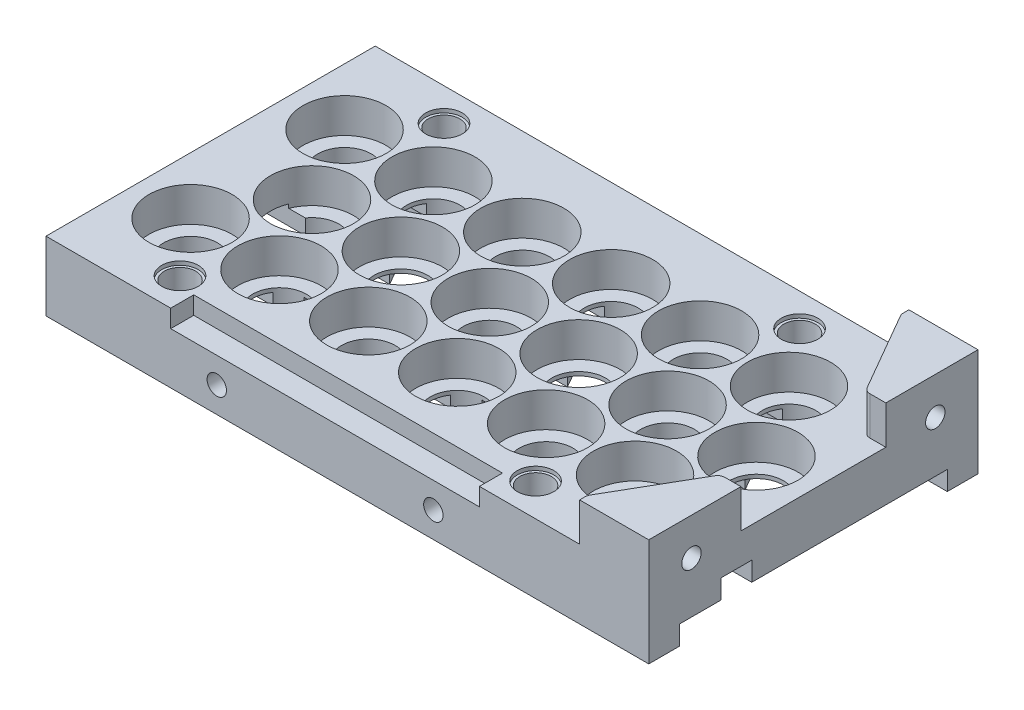
from build123d import *

# Parameters (mm, degrees)
BOSS_EXTRUDE2_DEPTH      = 11
BOSS_EXTRUDE2_DEPTH_BACK = 2
SKETCH1_W                = 156.975
SKETCH1_H                = 85.746976195
SKETCH1_R                = 10.825
BOSS_EXTRUDE3_DEPTH      = 2
BOSS_EXTRUDE3_DEPTH_BACK = 2
SKETCH1_3_R              = 10.825
SKETCH1_3_R_2            = 7
CUT_EXTRUDE3_REACH       = 157.996
SKETCH9_R                = 4.1
SKETCH10_R               = 4.7625
CUT_EXTRUDE4_DEPTH       = 1
SKETCH13_W               = 17.3
SKETCH13_H               = 8
SKETCH13_W_2             = 74.4
SKETCH13_W_3             = 28.875
BOSS_EXTRUDE7_DEPTH      = 5
CUT_EXTRUDE1_DEPTH       = 3
SKETCH19_W               = 80.4
SKETCH19_H               = 4.625
CUT_EXTRUDE6_DEPTH       = 6
SKETCH20_R               = 2.525
CUT_EXTRUDE7_DEPTH       = 3.8862
BOSS_EXTRUDE8_DEPTH      = 10
SKETCH22_R               = 2.525
CUT_EXTRUDE8_DEPTH       = 3.81
SKETCH26_R               = 1.9431
CUT_EXTRUDE9_DEPTH       = 5
CUT_EXTRUDE10_DEPTH      = 5
SKETCH28_R               = 1.9431
CUT_EXTRUDE11_DEPTH      = 5
FILLET4_R                = 2


with BuildPart() as part:
    # Sketch1 → Boss-Extrude2 (new, two sides: drawn at the far end of the back side and taken through both)
    with BuildSketch(Plane(origin=(0, 0, 0), x_dir=(1, 0, 0), z_dir=(0, 1, 0)).offset(-BOSS_EXTRUDE2_DEPTH_BACK)):
        with Locations((63.6625, -20.048488098)):
            Rectangle(SKETCH1_W, SKETCH1_H)
        with Locations(Location((115.75, -40.096976195, 0), (0, 0, 270))):
            Circle(SKETCH1_R, mode=Mode.SUBTRACT)
        with Locations(Location((127.325, -20.048488098, 0), (0, 0, 270))):
            Circle(SKETCH1_R, mode=Mode.SUBTRACT)
        with Locations(Location((115.75, 0, 0), (0, 0, 270))):
            Circle(SKETCH1_R, mode=Mode.SUBTRACT)
        with Locations(Location((92.6, -40.096976195, 0), (0, 0, 270))):
            Circle(SKETCH1_R, mode=Mode.SUBTRACT)
        with Locations(Location((104.175, -20.048488098, 0), (0, 0, 270))):
            Circle(SKETCH1_R, mode=Mode.SUBTRACT)
        with Locations(Location((92.6, 0, 0), (0, 0, 270))):
            Circle(SKETCH1_R, mode=Mode.SUBTRACT)
        with Locations(Location((69.45, -40.096976195, 0), (0, 0, 270))):
            Circle(SKETCH1_R, mode=Mode.SUBTRACT)
        with Locations(Location((81.025, -20.048488098, 0), (0, 0, 270))):
            Circle(SKETCH1_R, mode=Mode.SUBTRACT)
        with Locations(Location((69.45, 0, 0), (0, 0, 270))):
            Circle(SKETCH1_R, mode=Mode.SUBTRACT)
        with Locations(Location((46.3, -40.096976195, 0), (0, 0, 270))):
            Circle(SKETCH1_R, mode=Mode.SUBTRACT)
        with Locations(Location((57.875, -20.048488098, 0), (0, 0, 270))):
            Circle(SKETCH1_R, mode=Mode.SUBTRACT)
        with Locations(Location((46.3, 0, 0), (0, 0, 270))):
            Circle(SKETCH1_R, mode=Mode.SUBTRACT)
        with Locations(Location((23.15, -40.096976195, 0), (0, 0, 270))):
            Circle(SKETCH1_R, mode=Mode.SUBTRACT)
        with Locations(Location((34.725, -20.048488098, 0), (0, 0, 270))):
            Circle(SKETCH1_R, mode=Mode.SUBTRACT)
        with Locations(Location((23.15, 0, 0), (0, 0, 270))):
            Circle(SKETCH1_R, mode=Mode.SUBTRACT)
        with Locations(Location((0, -40.096976195, 0), (0, 0, 270))):
            Circle(SKETCH1_R, mode=Mode.SUBTRACT)
        with Locations(Location((11.575, -20.048488098, 0), (0, 0, 270))):
            Circle(SKETCH1_R, mode=Mode.SUBTRACT)
        with Locations(Location((0, 0, 0), (0, 0, 270))):
            Circle(SKETCH1_R, mode=Mode.SUBTRACT)
    extrude(amount=BOSS_EXTRUDE2_DEPTH + BOSS_EXTRUDE2_DEPTH_BACK)

    # Sketch1<3> → Boss-Extrude3 (add, two sides: drawn at the far end of the back side and taken through both)
    # profile 1 of 18: a face of its own
    with BuildSketch(Plane(origin=(0, 0, 0), x_dir=(1, 0, 0), z_dir=(0, 1, 0)).offset(-BOSS_EXTRUDE3_DEPTH_BACK)):
        with Locations(Location((0, 0, 0), (0, 0, 270))):
            Circle(SKETCH1_3_R)
        with Locations(Location((0, 0, 0), (0, 0, 270))):
            Circle(SKETCH1_3_R_2, mode=Mode.SUBTRACT)
    # profile 2 of 18: a face of its own
    with BuildSketch(Plane(origin=(0, 0, 0), x_dir=(1, 0, 0), z_dir=(0, 1, 0)).offset(-BOSS_EXTRUDE3_DEPTH_BACK)):
        with Locations(Location((23.15, 0, 0), (0, 0, 270))):
            Circle(SKETCH1_3_R)
        with Locations(Location((23.15, 0, 0), (0, 0, 270))):
            Circle(SKETCH1_3_R_2, mode=Mode.SUBTRACT)
    # profile 3 of 18: a face of its own
    with BuildSketch(Plane(origin=(0, 0, 0), x_dir=(1, 0, 0), z_dir=(0, 1, 0)).offset(-BOSS_EXTRUDE3_DEPTH_BACK)):
        with Locations(Location((46.3, 0, 0), (0, 0, 270))):
            Circle(SKETCH1_3_R)
        with Locations(Location((46.3, 0, 0), (0, 0, 270))):
            Circle(SKETCH1_3_R_2, mode=Mode.SUBTRACT)
    # profile 4 of 18: a face of its own
    with BuildSketch(Plane(origin=(0, 0, 0), x_dir=(1, 0, 0), z_dir=(0, 1, 0)).offset(-BOSS_EXTRUDE3_DEPTH_BACK)):
        with Locations(Location((69.45, 0, 0), (0, 0, 270))):
            Circle(SKETCH1_3_R)
        with Locations(Location((69.45, 0, 0), (0, 0, 270))):
            Circle(SKETCH1_3_R_2, mode=Mode.SUBTRACT)
    # profile 5 of 18: a face of its own
    with BuildSketch(Plane(origin=(0, 0, 0), x_dir=(1, 0, 0), z_dir=(0, 1, 0)).offset(-BOSS_EXTRUDE3_DEPTH_BACK)):
        with Locations(Location((92.6, 0, 0), (0, 0, 270))):
            Circle(SKETCH1_3_R)
        with Locations(Location((92.6, 0, 0), (0, 0, 270))):
            Circle(SKETCH1_3_R_2, mode=Mode.SUBTRACT)
    # profile 6 of 18: a face of its own
    with BuildSketch(Plane(origin=(0, 0, 0), x_dir=(1, 0, 0), z_dir=(0, 1, 0)).offset(-BOSS_EXTRUDE3_DEPTH_BACK)):
        with Locations(Location((115.75, 0, 0), (0, 0, 270))):
            Circle(SKETCH1_3_R)
        with Locations(Location((115.75, 0, 0), (0, 0, 270))):
            Circle(SKETCH1_3_R_2, mode=Mode.SUBTRACT)
    # profile 7 of 18: a face of its own
    with BuildSketch(Plane(origin=(0, 0, 0), x_dir=(1, 0, 0), z_dir=(0, 1, 0)).offset(-BOSS_EXTRUDE3_DEPTH_BACK)):
        with Locations(Location((11.575, -20.048488098, 0), (0, 0, 270))):
            Circle(SKETCH1_3_R)
        with Locations(Location((11.575, -20.048488098, 0), (0, 0, 270))):
            Circle(SKETCH1_3_R_2, mode=Mode.SUBTRACT)
    # profile 8 of 18: a face of its own
    with BuildSketch(Plane(origin=(0, 0, 0), x_dir=(1, 0, 0), z_dir=(0, 1, 0)).offset(-BOSS_EXTRUDE3_DEPTH_BACK)):
        with Locations(Location((34.725, -20.048488098, 0), (0, 0, 270))):
            Circle(SKETCH1_3_R)
        with Locations(Location((34.725, -20.048488098, 0), (0, 0, 270))):
            Circle(SKETCH1_3_R_2, mode=Mode.SUBTRACT)
    # profile 9 of 18: a face of its own
    with BuildSketch(Plane(origin=(0, 0, 0), x_dir=(1, 0, 0), z_dir=(0, 1, 0)).offset(-BOSS_EXTRUDE3_DEPTH_BACK)):
        with Locations(Location((57.875, -20.048488098, 0), (0, 0, 270))):
            Circle(SKETCH1_3_R)
        with Locations(Location((57.875, -20.048488098, 0), (0, 0, 270))):
            Circle(SKETCH1_3_R_2, mode=Mode.SUBTRACT)
    # profile 10 of 18: a face of its own
    with BuildSketch(Plane(origin=(0, 0, 0), x_dir=(1, 0, 0), z_dir=(0, 1, 0)).offset(-BOSS_EXTRUDE3_DEPTH_BACK)):
        with Locations(Location((81.025, -20.048488098, 0), (0, 0, 270))):
            Circle(SKETCH1_3_R)
        with Locations(Location((81.025, -20.048488098, 0), (0, 0, 270))):
            Circle(SKETCH1_3_R_2, mode=Mode.SUBTRACT)
    # profile 11 of 18: a face of its own
    with BuildSketch(Plane(origin=(0, 0, 0), x_dir=(1, 0, 0), z_dir=(0, 1, 0)).offset(-BOSS_EXTRUDE3_DEPTH_BACK)):
        with Locations(Location((104.175, -20.048488098, 0), (0, 0, 270))):
            Circle(SKETCH1_3_R)
        with Locations(Location((104.175, -20.048488098, 0), (0, 0, 270))):
            Circle(SKETCH1_3_R_2, mode=Mode.SUBTRACT)
    # profile 12 of 18: a face of its own
    with BuildSketch(Plane(origin=(0, 0, 0), x_dir=(1, 0, 0), z_dir=(0, 1, 0)).offset(-BOSS_EXTRUDE3_DEPTH_BACK)):
        with Locations(Location((127.325, -20.048488098, 0), (0, 0, 270))):
            Circle(SKETCH1_3_R)
        with Locations(Location((127.325, -20.048488098, 0), (0, 0, 270))):
            Circle(SKETCH1_3_R_2, mode=Mode.SUBTRACT)
    # profile 13 of 18: a face of its own
    with BuildSketch(Plane(origin=(0, 0, 0), x_dir=(1, 0, 0), z_dir=(0, 1, 0)).offset(-BOSS_EXTRUDE3_DEPTH_BACK)):
        with Locations(Location((115.75, -40.096976195, 0), (0, 0, 270))):
            Circle(SKETCH1_3_R)
        with Locations(Location((115.75, -40.096976195, 0), (0, 0, 270))):
            Circle(SKETCH1_3_R_2, mode=Mode.SUBTRACT)
    # profile 14 of 18: a face of its own
    with BuildSketch(Plane(origin=(0, 0, 0), x_dir=(1, 0, 0), z_dir=(0, 1, 0)).offset(-BOSS_EXTRUDE3_DEPTH_BACK)):
        with Locations(Location((92.6, -40.096976195, 0), (0, 0, 270))):
            Circle(SKETCH1_3_R)
        with Locations(Location((92.6, -40.096976195, 0), (0, 0, 270))):
            Circle(SKETCH1_3_R_2, mode=Mode.SUBTRACT)
    # profile 15 of 18: a face of its own
    with BuildSketch(Plane(origin=(0, 0, 0), x_dir=(1, 0, 0), z_dir=(0, 1, 0)).offset(-BOSS_EXTRUDE3_DEPTH_BACK)):
        with Locations(Location((69.45, -40.096976195, 0), (0, 0, 270))):
            Circle(SKETCH1_3_R)
        with Locations(Location((69.45, -40.096976195, 0), (0, 0, 270))):
            Circle(SKETCH1_3_R_2, mode=Mode.SUBTRACT)
    # profile 16 of 18: a face of its own
    with BuildSketch(Plane(origin=(0, 0, 0), x_dir=(1, 0, 0), z_dir=(0, 1, 0)).offset(-BOSS_EXTRUDE3_DEPTH_BACK)):
        with Locations(Location((46.3, -40.096976195, 0), (0, 0, 270))):
            Circle(SKETCH1_3_R)
        with Locations(Location((46.3, -40.096976195, 0), (0, 0, 270))):
            Circle(SKETCH1_3_R_2, mode=Mode.SUBTRACT)
    # profile 17 of 18: a face of its own
    with BuildSketch(Plane(origin=(0, 0, 0), x_dir=(1, 0, 0), z_dir=(0, 1, 0)).offset(-BOSS_EXTRUDE3_DEPTH_BACK)):
        with Locations(Location((23.15, -40.096976195, 0), (0, 0, 270))):
            Circle(SKETCH1_3_R)
        with Locations(Location((23.15, -40.096976195, 0), (0, 0, 270))):
            Circle(SKETCH1_3_R_2, mode=Mode.SUBTRACT)
    # profile 18 of 18: a face of its own
    with BuildSketch(Plane(origin=(0, 0, 0), x_dir=(1, 0, 0), z_dir=(0, 1, 0)).offset(-BOSS_EXTRUDE3_DEPTH_BACK)):
        with Locations(Location((0, -40.096976195, 0), (0, 0, 270))):
            Circle(SKETCH1_3_R)
        with Locations(Location((0, -40.096976195, 0), (0, 0, 270))):
            Circle(SKETCH1_3_R_2, mode=Mode.SUBTRACT)
    extrude(amount=BOSS_EXTRUDE3_DEPTH + BOSS_EXTRUDE3_DEPTH_BACK)

    # Sketch9 → Cut-Extrude3 (cut, up to next)
    with BuildSketch(Plane(origin=(0, 11, 0), x_dir=(1, 0, 0), z_dir=(0, 1, 0)), mode=Mode.PRIVATE) as cut_extrude3_sk1:
        with Locations(Location((11.575, 14.325, 0), (0, 0, 270))):
            Circle(SKETCH9_R)
    cut_extrude3_tool1 = extrude(cut_extrude3_sk1.sketch, amount=-CUT_EXTRUDE3_REACH, mode=Mode.PRIVATE) & part.part
    # Sketch9 → Cut-Extrude3 (cut, up to next)
    with BuildSketch(Plane(origin=(0, 11, 0), x_dir=(1, 0, 0), z_dir=(0, 1, 0)), mode=Mode.PRIVATE) as cut_extrude3_sk2:
        with Locations(Location((11.575, -54.421976195, 0), (0, 0, 270))):
            Circle(SKETCH9_R)
    cut_extrude3_tool2 = extrude(cut_extrude3_sk2.sketch, amount=-CUT_EXTRUDE3_REACH, mode=Mode.PRIVATE) & part.part
    # Sketch9 → Cut-Extrude3 (cut, up to next)
    with BuildSketch(Plane(origin=(0, 11, 0), x_dir=(1, 0, 0), z_dir=(0, 1, 0)), mode=Mode.PRIVATE) as cut_extrude3_sk3:
        with Locations(Location((104.175, -54.421976195, 0), (0, 0, 270))):
            Circle(SKETCH9_R)
    cut_extrude3_tool3 = extrude(cut_extrude3_sk3.sketch, amount=-CUT_EXTRUDE3_REACH, mode=Mode.PRIVATE) & part.part
    # Sketch9 → Cut-Extrude3 (cut, up to next)
    with BuildSketch(Plane(origin=(0, 11, 0), x_dir=(1, 0, 0), z_dir=(0, 1, 0)), mode=Mode.PRIVATE) as cut_extrude3_sk4:
        with Locations(Location((104.175, 14.325, 0), (0, 0, 270))):
            Circle(SKETCH9_R)
    cut_extrude3_tool4 = extrude(cut_extrude3_sk4.sketch, amount=-CUT_EXTRUDE3_REACH, mode=Mode.PRIVATE) & part.part
    add(cut_extrude3_tool1.solids().sort_by_distance((11.575, 11, -14.325))[0], mode=Mode.SUBTRACT)
    add(cut_extrude3_tool2.solids().sort_by_distance((11.575, 11, 54.421976))[0], mode=Mode.SUBTRACT)
    add(cut_extrude3_tool3.solids().sort_by_distance((104.175, 11, 54.421976))[0], mode=Mode.SUBTRACT)
    add(cut_extrude3_tool4.solids().sort_by_distance((104.175, 11, -14.325))[0], mode=Mode.SUBTRACT)

    # Sketch10 → Cut-Extrude4 (cut)
    with BuildSketch(Plane(origin=(0, 11, 0), x_dir=(1, 0, 0), z_dir=(0, 1, 0))):
        with Locations(Location((11.575, 14.325, 0), (0, 0, 270))):
            Circle(SKETCH10_R)
        with Locations(Location((104.175, 14.325, 0), (0, 0, 270))):
            Circle(SKETCH10_R)
        with Locations(Location((104.175, -54.421976195, 0), (0, 0, 270))):
            Circle(SKETCH10_R)
        with Locations(Location((11.575, -54.421976195, 0), (0, 0, 270))):
            Circle(SKETCH10_R)
    extrude(amount=-CUT_EXTRUDE4_DEPTH, mode=Mode.SUBTRACT)

    # Sketch13 → Boss-Extrude7 (add)
    with BuildSketch(Plane.XZ.offset(2)):
        with Locations((-6.175, 58.921976195)):
            Rectangle(SKETCH13_W, SKETCH13_H)
        with BuildLine():
            Line((2.475, 62.921976195), (2.475, 54.921976195))
            Line((2.475, 54.921976195), (2.488746647, 54.921976195))
            ThreePointArc((2.488746647, 54.921976195), (4.2235774, 59.78542525), (8.325384638, 62.921976195))
            Line((8.325384638, 62.921976195), (2.475, 62.921976195))
        make_face()
        with Locations((57.875, 58.921976195)):
            Rectangle(SKETCH13_W_2, SKETCH13_H)
        with BuildLine():
            Line((20.661253353, 54.921976195), (20.675, 54.921976195))
            Line((20.675, 54.921976195), (20.675, 62.921976195))
            Line((20.675, 62.921976195), (14.824615362, 62.921976195))
            ThreePointArc((14.824615362, 62.921976195), (18.9264226, 59.78542525), (20.661253353, 54.921976195))
        make_face()
        with BuildLine():
            ThreePointArc((8.325384638, 62.921976195), (4.2235774, 59.78542525), (2.488746647, 54.921976195))
            Line((2.488746647, 54.921976195), (4.242651581, 54.921976195))
            Line((4.242651581, 54.921976195), (7.764488223, 61.021976195))
            Line((7.764488223, 61.021976195), (15.385511777, 61.021976195))
            Line((15.385511777, 61.021976195), (18.907348419, 54.921976195))
            Line((18.907348419, 54.921976195), (20.661253353, 54.921976195))
            ThreePointArc((20.661253353, 54.921976195), (18.9264226, 59.78542525), (14.824615362, 62.921976195))
            Line((14.824615362, 62.921976195), (8.325384638, 62.921976195))
        make_face()
        with BuildLine():
            ThreePointArc((2.488746647, 54.921976195), (2.478437311, 54.672070663), (2.475, 54.421976195))
            ThreePointArc((2.475, 54.421976195), (11.575, 45.321976195), (20.675, 54.421976195))
            ThreePointArc((20.675, 54.421976195), (20.671562689, 54.672070663), (20.661253353, 54.921976195))
            Line((20.661253353, 54.921976195), (18.907348419, 54.921976195))
            Line((18.907348419, 54.921976195), (19.196023553, 54.421976195))
            Line((19.196023553, 54.421976195), (15.385511777, 47.821976195))
            Line((15.385511777, 47.821976195), (7.764488223, 47.821976195))
            Line((7.764488223, 47.821976195), (3.953976447, 54.421976195))
            Line((3.953976447, 54.421976195), (4.242651581, 54.921976195))
            Line((4.242651581, 54.921976195), (2.488746647, 54.921976195))
        make_face()
        with Locations((127.7125, 58.921976195)):
            Rectangle(SKETCH13_W_3, SKETCH13_H)
        with BuildLine():
            Line((113.275, 62.921976195), (107.424615362, 62.921976195))
            ThreePointArc((107.424615362, 62.921976195), (111.5264226, 59.78542525), (113.261253353, 54.921976195))
            Line((113.261253353, 54.921976195), (113.275, 54.921976195))
            Line((113.275, 54.921976195), (113.275, 62.921976195))
        make_face()
        with BuildLine():
            Line((95.075, 62.921976195), (95.075, 54.921976195))
            Line((95.075, 54.921976195), (95.088746647, 54.921976195))
            ThreePointArc((95.088746647, 54.921976195), (96.8235774, 59.78542525), (100.925384638, 62.921976195))
            Line((100.925384638, 62.921976195), (95.075, 62.921976195))
        make_face()
        with BuildLine():
            ThreePointArc((100.925384638, 62.921976195), (96.8235774, 59.78542525), (95.088746647, 54.921976195))
            Line((95.088746647, 54.921976195), (96.842651581, 54.921976195))
            Line((96.842651581, 54.921976195), (100.364488223, 61.021976195))
            Line((100.364488223, 61.021976195), (107.985511777, 61.021976195))
            Line((107.985511777, 61.021976195), (111.507348419, 54.921976195))
            Line((111.507348419, 54.921976195), (113.261253353, 54.921976195))
            ThreePointArc((113.261253353, 54.921976195), (111.5264226, 59.78542525), (107.424615362, 62.921976195))
            Line((107.424615362, 62.921976195), (100.925384638, 62.921976195))
        make_face()
        with BuildLine():
            Line((96.842651581, 54.921976195), (95.088746647, 54.921976195))
            ThreePointArc((95.088746647, 54.921976195), (95.078437311, 54.672070663), (95.075, 54.421976195))
            ThreePointArc((95.075, 54.421976195), (104.175, 45.321976195), (113.275, 54.421976195))
            ThreePointArc((113.275, 54.421976195), (113.271562689, 54.672070663), (113.261253353, 54.921976195))
            Line((113.261253353, 54.921976195), (111.507348419, 54.921976195))
            Line((111.507348419, 54.921976195), (111.796023553, 54.421976195))
            Line((111.796023553, 54.421976195), (107.985511777, 47.821976195))
            Line((107.985511777, 47.821976195), (100.364488223, 47.821976195))
            Line((100.364488223, 47.821976195), (96.553976447, 54.421976195))
            Line((96.553976447, 54.421976195), (96.842651581, 54.921976195))
        make_face()
        with Locations((-6.175, -18.825)):
            Rectangle(SKETCH13_W, SKETCH13_H)
        with BuildLine():
            Line((2.488746647, -14.825), (2.475, -14.825))
            Line((2.475, -14.825), (2.475, -22.825))
            Line((2.475, -22.825), (8.325384638, -22.825))
            ThreePointArc((8.325384638, -22.825), (4.2235774, -19.688449055), (2.488746647, -14.825))
        make_face()
        with Locations((57.875, -18.825)):
            Rectangle(SKETCH13_W_2, SKETCH13_H)
        with BuildLine():
            ThreePointArc((20.661253353, -14.825), (18.9264226, -19.688449055), (14.824615362, -22.825))
            Line((14.824615362, -22.825), (20.675, -22.825))
            Line((20.675, -22.825), (20.675, -14.825))
            Line((20.675, -14.825), (20.661253353, -14.825))
        make_face()
        with BuildLine():
            ThreePointArc((2.475, -14.325), (2.478437311, -14.575094467), (2.488746647, -14.825))
            Line((2.488746647, -14.825), (4.242651581, -14.825))
            Line((4.242651581, -14.825), (3.953976447, -14.325))
            Line((3.953976447, -14.325), (7.764488223, -7.725))
            Line((7.764488223, -7.725), (15.385511777, -7.725))
            Line((15.385511777, -7.725), (19.196023553, -14.325))
            Line((19.196023553, -14.325), (18.907348419, -14.825))
            Line((18.907348419, -14.825), (20.661253353, -14.825))
            ThreePointArc((20.661253353, -14.825), (20.671562689, -14.575094467), (20.675, -14.325))
            ThreePointArc((20.675, -14.325), (11.575, -5.225), (2.475, -14.325))
        make_face()
        with BuildLine():
            Line((4.242651581, -14.825), (2.488746647, -14.825))
            ThreePointArc((2.488746647, -14.825), (4.2235774, -19.688449055), (8.325384638, -22.825))
            Line((8.325384638, -22.825), (14.824615362, -22.825))
            ThreePointArc((14.824615362, -22.825), (18.9264226, -19.688449055), (20.661253353, -14.825))
            Line((20.661253353, -14.825), (18.907348419, -14.825))
            Line((18.907348419, -14.825), (15.385511777, -20.925))
            Line((15.385511777, -20.925), (7.764488223, -20.925))
            Line((7.764488223, -20.925), (4.242651581, -14.825))
        make_face()
        with BuildLine():
            Line((95.088746647, -14.825), (95.075, -14.825))
            Line((95.075, -14.825), (95.075, -22.825))
            Line((95.075, -22.825), (100.925384638, -22.825))
            ThreePointArc((100.925384638, -22.825), (96.8235774, -19.688449055), (95.088746647, -14.825))
        make_face()
        with Locations((127.7125, -18.825)):
            Rectangle(SKETCH13_W_3, SKETCH13_H)
        with BuildLine():
            Line((96.842651581, -14.825), (95.088746647, -14.825))
            ThreePointArc((95.088746647, -14.825), (96.8235774, -19.688449055), (100.925384638, -22.825))
            Line((100.925384638, -22.825), (107.424615362, -22.825))
            ThreePointArc((107.424615362, -22.825), (111.5264226, -19.688449055), (113.261253353, -14.825))
            Line((113.261253353, -14.825), (111.507348419, -14.825))
            Line((111.507348419, -14.825), (107.985511777, -20.925))
            Line((107.985511777, -20.925), (100.364488223, -20.925))
            Line((100.364488223, -20.925), (96.842651581, -14.825))
        make_face()
        with BuildLine():
            Line((113.275, -22.825), (113.275, -14.825))
            Line((113.275, -14.825), (113.261253353, -14.825))
            ThreePointArc((113.261253353, -14.825), (111.5264226, -19.688449055), (107.424615362, -22.825))
            Line((107.424615362, -22.825), (113.275, -22.825))
        make_face()
        with BuildLine():
            ThreePointArc((95.075, -14.325), (95.078437311, -14.575094467), (95.088746647, -14.825))
            Line((95.088746647, -14.825), (96.842651581, -14.825))
            Line((96.842651581, -14.825), (96.553976447, -14.325))
            Line((96.553976447, -14.325), (100.364488223, -7.725))
            Line((100.364488223, -7.725), (107.985511777, -7.725))
            Line((107.985511777, -7.725), (111.796023553, -14.325))
            Line((111.796023553, -14.325), (111.507348419, -14.825))
            Line((111.507348419, -14.825), (113.261253353, -14.825))
            ThreePointArc((113.261253353, -14.825), (113.271562689, -14.575094467), (113.275, -14.325))
            ThreePointArc((113.275, -14.325), (104.175, -5.225), (95.075, -14.325))
        make_face()
    extrude(amount=BOSS_EXTRUDE7_DEPTH)

    # Sketch2 → Cut-Extrude1 (cut)
    with BuildSketch(Plane.XZ.offset(2)):
        with BuildLine():
            ThreePointArc((7, 40.096976195), (6.832081695, 38.57294873), (6.336382938, 37.12203901))
            Line((6.336382938, 37.12203901), (6.92820323, 36.096976195))
            Line((6.92820323, 36.096976195), (17.405437353, 36.096976195))
            ThreePointArc((17.405437353, 36.096976195), (16.15, 40.096976195), (17.405437353, 44.096976195))
            Line((17.405437353, 44.096976195), (5.744562647, 44.096976195))
            ThreePointArc((5.744562647, 44.096976195), (6.678770041, 42.193170541), (7, 40.096976195))
        make_face()
        with BuildLine():
            Line((27.79679677, 24.048488098), (17.319562647, 24.048488098))
            ThreePointArc((17.319562647, 24.048488098), (18.253770041, 22.144682444), (18.575, 20.048488098))
            ThreePointArc((18.575, 20.048488098), (18.253770041, 17.952293751), (17.319562647, 16.048488098))
            Line((17.319562647, 16.048488098), (27.79679677, 16.048488098))
            Line((27.79679677, 16.048488098), (28.388617062, 17.073550912))
            ThreePointArc((28.388617062, 17.073550912), (27.725, 20.048488098), (28.388617062, 23.023425283))
            Line((28.388617062, 23.023425283), (27.79679677, 24.048488098))
        make_face()
        with BuildLine():
            Line((63.705437353, 44.096976195), (52.044562647, 44.096976195))
            ThreePointArc((52.044562647, 44.096976195), (52.978770041, 42.193170541), (53.3, 40.096976195))
            ThreePointArc((53.3, 40.096976195), (53.132081695, 38.57294873), (52.636382938, 37.12203901))
            Line((52.636382938, 37.12203901), (53.22820323, 36.096976195))
            Line((53.22820323, 36.096976195), (63.705437353, 36.096976195))
            ThreePointArc((63.705437353, 36.096976195), (62.45, 40.096976195), (63.705437353, 44.096976195))
        make_face()
        with BuildLine():
            ThreePointArc((75.194562647, 36.096976195), (72.424937186, 33.760593257), (68.858179708, 33.12203901))
            Line((68.858179708, 33.12203901), (74.09679677, 24.048488098))
            Line((74.09679677, 24.048488098), (75.280437353, 24.048488098))
            ThreePointArc((75.280437353, 24.048488098), (78.050062814, 26.384871036), (81.616820292, 27.023425283))
            Line((81.616820292, 27.023425283), (76.37820323, 36.096976195))
            Line((76.37820323, 36.096976195), (75.194562647, 36.096976195))
        make_face()
        with BuildLine():
            Line((110.005437353, 44.096976195), (98.344562647, 44.096976195))
            ThreePointArc((98.344562647, 44.096976195), (99.278770041, 42.193170541), (99.6, 40.096976195))
            ThreePointArc((99.6, 40.096976195), (99.432081695, 38.57294873), (98.936382938, 37.12203901))
            Line((98.936382938, 37.12203901), (99.52820323, 36.096976195))
            Line((99.52820323, 36.096976195), (110.005437353, 36.096976195))
            ThreePointArc((110.005437353, 36.096976195), (108.75, 40.096976195), (110.005437353, 44.096976195))
        make_face()
        with BuildLine():
            Line((120.988617062, 23.023425283), (120.39679677, 24.048488098))
            Line((120.39679677, 24.048488098), (109.919562647, 24.048488098))
            ThreePointArc((109.919562647, 24.048488098), (110.853770041, 22.144682444), (111.175, 20.048488098))
            ThreePointArc((111.175, 20.048488098), (110.853770041, 17.952293751), (109.919562647, 16.048488098))
            Line((109.919562647, 16.048488098), (120.39679677, 16.048488098))
            Line((120.39679677, 16.048488098), (120.988617062, 17.073550912))
            ThreePointArc((120.988617062, 17.073550912), (120.325, 20.048488098), (120.988617062, 23.023425283))
        make_face()
        with BuildLine():
            Line((74.688617062, 23.023425283), (74.09679677, 24.048488098))
            Line((74.09679677, 24.048488098), (63.619562647, 24.048488098))
            ThreePointArc((63.619562647, 24.048488098), (64.553770041, 22.144682444), (64.875, 20.048488098))
            ThreePointArc((64.875, 20.048488098), (64.553770041, 17.952293751), (63.619562647, 16.048488098))
            Line((63.619562647, 16.048488098), (74.09679677, 16.048488098))
            Line((74.09679677, 16.048488098), (74.688617062, 17.073550912))
            ThreePointArc((74.688617062, 17.073550912), (74.025, 20.048488098), (74.688617062, 23.023425283))
        make_face()
        with BuildLine():
            ThreePointArc((7, 0), (6.678770041, -2.096194346), (5.744562647, -4))
            Line((5.744562647, -4), (17.405437353, -4))
            ThreePointArc((17.405437353, -4), (16.15, 0), (17.405437353, 4))
            Line((17.405437353, 4), (6.92820323, 4))
            Line((6.92820323, 4), (6.336382938, 2.974937186))
            ThreePointArc((6.336382938, 2.974937186), (6.832081695, 1.524027465), (7, 0))
        make_face()
        with BuildLine():
            ThreePointArc((53.3, 0), (52.978770041, -2.096194346), (52.044562647, -4))
            Line((52.044562647, -4), (63.705437353, -4))
            ThreePointArc((63.705437353, -4), (62.45, 0), (63.705437353, 4))
            Line((63.705437353, 4), (53.22820323, 4))
            Line((53.22820323, 4), (52.636382938, 2.974937186))
            ThreePointArc((52.636382938, 2.974937186), (53.132081695, 1.524027465), (53.3, 0))
        make_face()
        with BuildLine():
            ThreePointArc((99.6, 0), (99.278770041, -2.096194346), (98.344562647, -4))
            Line((98.344562647, -4), (110.005437353, -4))
            ThreePointArc((110.005437353, -4), (108.75, 0), (110.005437353, 4))
            Line((110.005437353, 4), (99.52820323, 4))
            Line((99.52820323, 4), (98.936382938, 2.974937186))
            ThreePointArc((98.936382938, 2.974937186), (99.432081695, 1.524027465), (99.6, 0))
        make_face()
        with BuildLine():
            Line((75.280437353, 16.048488098), (74.09679677, 16.048488098))
            Line((74.09679677, 16.048488098), (68.858179708, 6.974937186))
            ThreePointArc((68.858179708, 6.974937186), (72.424937186, 6.336382938), (75.194562647, 4))
            Line((75.194562647, 4), (76.37820323, 4))
            Line((76.37820323, 4), (81.616820292, 13.073550912))
            ThreePointArc((81.616820292, 13.073550912), (78.050062814, 13.712105159), (75.280437353, 16.048488098))
        make_face()
        with BuildLine():
            Line((53.22820323, 36.096976195), (52.636382938, 37.12203901))
            ThreePointArc((52.636382938, 37.12203901), (52.362177826, 36.596976195), (52.044562647, 36.096976195))
            Line((52.044562647, 36.096976195), (53.22820323, 36.096976195))
        make_face()
        with BuildLine():
            Line((99.52820323, 36.096976195), (98.936382938, 37.12203901))
            ThreePointArc((98.936382938, 37.12203901), (98.662177826, 36.596976195), (98.344562647, 36.096976195))
            Line((98.344562647, 36.096976195), (99.52820323, 36.096976195))
        make_face()
        with BuildLine():
            Line((76.37820323, 36.096976195), (75.786382938, 37.12203901))
            ThreePointArc((75.786382938, 37.12203901), (75.512177826, 36.596976195), (75.194562647, 36.096976195))
            Line((75.194562647, 36.096976195), (76.37820323, 36.096976195))
        make_face()
        with BuildLine():
            Line((28.980437353, 24.048488098), (27.79679677, 24.048488098))
            Line((27.79679677, 24.048488098), (28.388617062, 23.023425283))
            ThreePointArc((28.388617062, 23.023425283), (28.662822174, 23.548488098), (28.980437353, 24.048488098))
        make_face()
        with BuildLine():
            Line((6.92820323, 4), (5.744562647, 4))
            ThreePointArc((5.744562647, 4), (6.062177826, 3.5), (6.336382938, 2.974937186))
            Line((6.336382938, 2.974937186), (6.92820323, 4))
        make_face()
        with BuildLine():
            Line((53.22820323, 4), (52.044562647, 4))
            ThreePointArc((52.044562647, 4), (52.362177826, 3.5), (52.636382938, 2.974937186))
            Line((52.636382938, 2.974937186), (53.22820323, 4))
        make_face()
        with BuildLine():
            ThreePointArc((75.194562647, 4), (75.512177826, 3.5), (75.786382938, 2.974937186))
            Line((75.786382938, 2.974937186), (76.37820323, 4))
            Line((76.37820323, 4), (75.194562647, 4))
        make_face()
        with BuildLine():
            ThreePointArc((98.344562647, 4), (98.662177826, 3.5), (98.936382938, 2.974937186))
            Line((98.936382938, 2.974937186), (99.52820323, 4))
            Line((99.52820323, 4), (98.344562647, 4))
        make_face()
        with BuildLine():
            Line((121.580437353, 24.048488098), (120.39679677, 24.048488098))
            Line((120.39679677, 24.048488098), (120.988617062, 23.023425283))
            ThreePointArc((120.988617062, 23.023425283), (121.262822174, 23.548488098), (121.580437353, 24.048488098))
        make_face()
        with BuildLine():
            ThreePointArc((121.580437353, 16.048488098), (121.262822174, 16.548488098), (120.988617062, 17.073550912))
            Line((120.988617062, 17.073550912), (120.39679677, 16.048488098))
            Line((120.39679677, 16.048488098), (121.580437353, 16.048488098))
        make_face()
        with BuildLine():
            Line((75.280437353, 24.048488098), (74.09679677, 24.048488098))
            Line((74.09679677, 24.048488098), (74.688617062, 23.023425283))
            ThreePointArc((74.688617062, 23.023425283), (74.962822174, 23.548488098), (75.280437353, 24.048488098))
        make_face()
        with BuildLine():
            ThreePointArc((75.280437353, 16.048488098), (74.962822174, 16.548488098), (74.688617062, 17.073550912))
            Line((74.688617062, 17.073550912), (74.09679677, 16.048488098))
            Line((74.09679677, 16.048488098), (75.280437353, 16.048488098))
        make_face()
        with BuildLine():
            Line((28.980437353, 16.048488098), (27.79679677, 16.048488098))
            Line((27.79679677, 16.048488098), (22.558179708, 6.974937186))
            ThreePointArc((22.558179708, 6.974937186), (26.124937186, 6.336382938), (28.894562647, 4))
            Line((28.894562647, 4), (30.07820323, 4))
            Line((30.07820323, 4), (35.316820292, 13.073550912))
            ThreePointArc((35.316820292, 13.073550912), (31.750062814, 13.712105159), (28.980437353, 16.048488098))
        make_face()
        with BuildLine():
            ThreePointArc((28.980437353, 16.048488098), (28.662822174, 16.548488098), (28.388617062, 17.073550912))
            Line((28.388617062, 17.073550912), (27.79679677, 16.048488098))
            Line((27.79679677, 16.048488098), (28.980437353, 16.048488098))
        make_face()
        with BuildLine():
            ThreePointArc((29.486382938, 37.12203901), (29.212177826, 36.596976195), (28.894562647, 36.096976195))
            Line((28.894562647, 36.096976195), (30.07820323, 36.096976195))
            Line((30.07820323, 36.096976195), (29.486382938, 37.12203901))
        make_face()
        with BuildLine():
            Line((6.92820323, 36.096976195), (6.336382938, 37.12203901))
            ThreePointArc((6.336382938, 37.12203901), (6.062177826, 36.596976195), (5.744562647, 36.096976195))
            Line((5.744562647, 36.096976195), (6.92820323, 36.096976195))
        make_face()
        with BuildLine():
            ThreePointArc((110.005437353, 4), (108.75, 0), (110.005437353, -4))
            Line((110.005437353, -4), (115.75, -4))
            ThreePointArc((115.75, -4), (112.285898385, -2), (112.285898385, 2))
            Line((112.285898385, 2), (113.440598923, 4))
            Line((113.440598923, 4), (110.005437353, 4))
        make_face()
        with BuildLine():
            Line((127.916820292, 27.023425283), (122.086382938, 37.12203901))
            ThreePointArc((122.086382938, 37.12203901), (119.25, 34.034798369), (115.158179708, 33.12203901))
            Line((115.158179708, 33.12203901), (120.39679677, 24.048488098))
            Line((120.39679677, 24.048488098), (121.580437353, 24.048488098))
            ThreePointArc((121.580437353, 24.048488098), (124.350062814, 26.384871036), (127.916820292, 27.023425283))
        make_face()
        with BuildLine():
            Line((122.086382938, 2.974937186), (127.916820292, 13.073550912))
            ThreePointArc((127.916820292, 13.073550912), (124.350062814, 13.712105159), (121.580437353, 16.048488098))
            Line((121.580437353, 16.048488098), (120.39679677, 16.048488098))
            Line((120.39679677, 16.048488098), (115.158179708, 6.974937186))
            ThreePointArc((115.158179708, 6.974937186), (119.25, 6.062177826), (122.086382938, 2.974937186))
        make_face()
        with BuildLine():
            ThreePointArc((28.894562647, 36.096976195), (26.124937186, 33.760593257), (22.558179708, 33.12203901))
            Line((22.558179708, 33.12203901), (27.79679677, 24.048488098))
            Line((27.79679677, 24.048488098), (28.980437353, 24.048488098))
            ThreePointArc((28.980437353, 24.048488098), (31.750062814, 26.384871036), (35.316820292, 27.023425283))
            Line((35.316820292, 27.023425283), (30.07820323, 36.096976195))
            Line((30.07820323, 36.096976195), (28.894562647, 36.096976195))
        make_face()
        with BuildLine():
            Line((30.07820323, 4), (20.840598923, 4))
            Line((20.840598923, 4), (19.685898385, 2))
            ThreePointArc((19.685898385, 2), (19.685898382, -1.999999995), (23.14999999, -4))
            ThreePointArc((23.14999999, -4), (25.149999995, -3.464101618), (26.614101615, -2))
            Line((26.614101615, -2), (30.07820323, 4))
        make_face()
    extrude(amount=-CUT_EXTRUDE1_DEPTH, mode=Mode.SUBTRACT)

    # Sketch19 → Cut-Extrude6 (cut)
    with BuildSketch(Plane.XY.offset(62.921976195)):
        with Locations((57.85, 8.6875)):
            Rectangle(SKETCH19_W, SKETCH19_H)
    extrude(amount=-CUT_EXTRUDE6_DEPTH, mode=Mode.SUBTRACT)

    # Sketch20 → Cut-Extrude7 (cut)
    with BuildSketch(Plane.XY.offset(62.921976195)):
        with Locations((29.65, -0.3125)):
            Circle(SKETCH20_R)
        with Locations((86.05, -0.3125)):
            Circle(SKETCH20_R)
    extrude(amount=-CUT_EXTRUDE7_DEPTH, mode=Mode.SUBTRACT)

    # Sketch29 → Boss-Extrude8 (add)
    with BuildSketch(Plane(origin=(0, 11, 0), x_dir=(1, 0, 0), z_dir=(0, 1, 0))):
        Polygon((142.15, -1.175), (142.15, 22.825), (124.15, 22.825), (124.15, 20.825), (136.851705922, -1.175), align=None)
        Polygon((142.15, -62.921976195), (142.15, -38.921976195), (136.851705922, -38.921976195), (124.15, -60.921976195), (124.15, -62.921976195), align=None)
    extrude(amount=BOSS_EXTRUDE8_DEPTH)

    # Sketch22 → Cut-Extrude8 (cut)
    with BuildSketch(Plane(origin=(142.15, 0, 0), x_dir=(0, 0, -1), z_dir=(1, 0, 0))):
        with Locations((-51.798488098, 11.3)):
            Circle(SKETCH22_R)
        with Locations((11.701511902, 11.3)):
            Circle(SKETCH22_R)
    extrude(amount=-CUT_EXTRUDE8_DEPTH, mode=Mode.SUBTRACT)

    # Sketch26 → Cut-Extrude9 (cut)
    with BuildSketch(Plane.XZ.offset(2)):
        with Locations(Location((132.15, -9.4125, 0), (0, 0, 270))):
            Circle(SKETCH26_R)
        with Locations(Location((57.875, -9.4125, 0), (0, 0, 270))):
            Circle(SKETCH26_R)
        with Locations(Location((-10.825, -9.4125, 0), (0, 0, 270))):
            Circle(SKETCH26_R)
        with Locations(Location((-10.825, 49.509476195, 0), (0, 0, 90))):
            Circle(SKETCH26_R)
        with Locations(Location((57.875, 49.509476195, 0), (0, 0, 90))):
            Circle(SKETCH26_R)
        with Locations(Location((132.15, 49.509476195, 0), (0, 0, 90))):
            Circle(SKETCH26_R)
    extrude(amount=-CUT_EXTRUDE9_DEPTH, mode=Mode.SUBTRACT)

    # Sketch27 → Cut-Extrude10 (cut)
    with BuildSketch(Plane.XZ.offset(2)):
        with BuildLine():
            Line((11.575, 16.048488098), (-14.825, 16.048488098))
            ThreePointArc((-14.825, 16.048488098), (-18.825, 20.048488098), (-14.825, 24.048488098))
            Line((-14.825, 24.048488098), (11.575, 24.048488098))
            ThreePointArc((11.575, 24.048488098), (15.575, 20.048488098), (11.575, 16.048488098))
        make_face()
        with BuildLine():
            Line((115.75, 44.096976195), (142.15, 44.096976195))
            ThreePointArc((142.15, 44.096976195), (146.15, 40.096976195), (142.15, 36.096976195))
            Line((142.15, 36.096976195), (115.75, 36.096976195))
            ThreePointArc((115.75, 36.096976195), (111.75, 40.096976195), (115.75, 44.096976195))
        make_face()
    extrude(amount=-CUT_EXTRUDE10_DEPTH, mode=Mode.SUBTRACT)

    # Sketch28 → Cut-Extrude11 (cut)
    with BuildSketch(Plane.XZ.offset(-3)):
        with Locations(Location((-10.825, 20.048488098, 0), (0, 0, 270))):
            Circle(SKETCH28_R)
        with Locations(Location((-3.25, 20.048488098, 0), (0, 0, 270))):
            Circle(SKETCH28_R)
        with Locations(Location((130.575, 40.096976195, 0), (0, 0, 270))):
            Circle(SKETCH28_R)
        with Locations(Location((138.15, 40.096976195, 0), (0, 0, 270))):
            Circle(SKETCH28_R)
    extrude(amount=-CUT_EXTRUDE11_DEPTH, mode=Mode.SUBTRACT)

    # Fillet4
    fillet4_edges = [part.edges().sort_by_distance(p)[0] for p in [
        (136.851705922, 16, 1.175),
        (124.15, 16, -20.825),
        (136.851705922, 16, 38.921976195),
        (124.15, 16, 60.921976195),
    ]]
    fillet(fillet4_edges, radius=FILLET4_R)


solid = part.part
